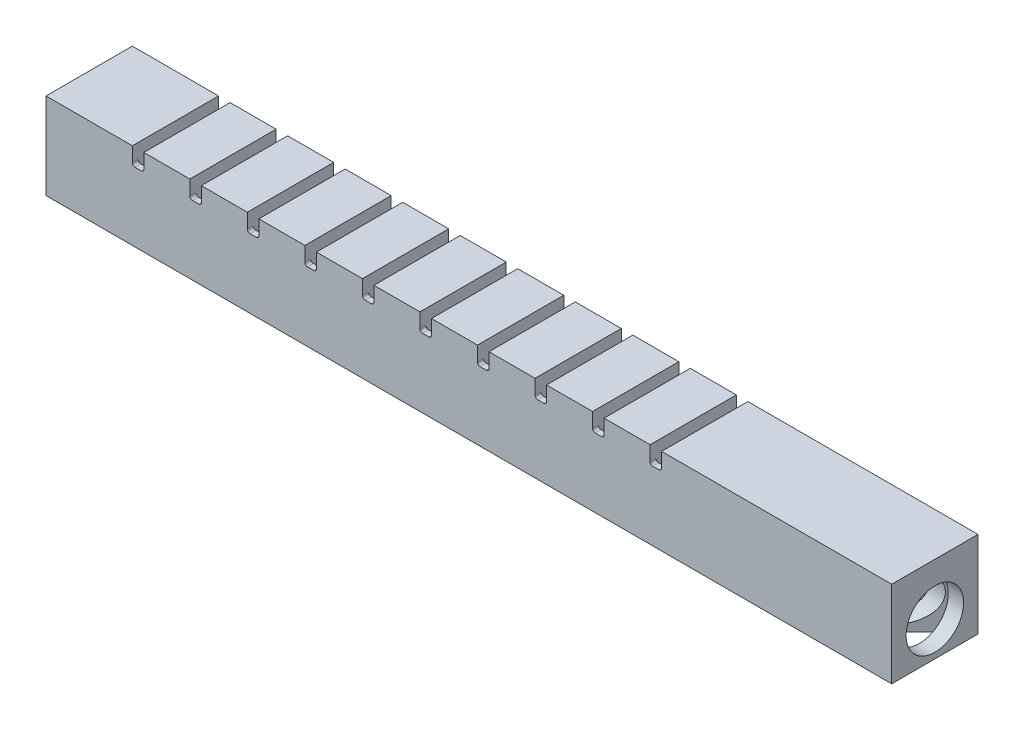
from build123d import *

# Parameters (mm, degrees)
SKETCH1_W                       = 8
SKETCH1_H                       = 15
FIRST_CHAMBER_BLOCK_DEPTH       = 15
SKETCH2_W                       = 6
SKETCH2_H                       = 11
FIRST_CHAMBER_CAVITY_DEPTH      = 13
SKETCH3_W                       = 15
SKETCH3_H                       = 3
CHAMBER_SPACER_DEPTH            = 2
PATTERN_CHAMBERS_COUNT          = 11
PATTERN_CHAMBERS_PITCH          = 10
SKETCH4_W                       = 15
SKETCH4_H                       = 12
THICKEN_END_1_DEPTH             = 2
SKETCH5_W                       = 15
SKETCH5_H                       = 15
THICKEN_END_2_DEPTH             = 2
SKETCH6_W                       = 94
SKETCH6_H                       = 2
CENTRAL_AIR_CHANNEL_DEPTH       = 2
AUFSATZ_LINEAR_AUSTRAGEN3_REACH = 106.183
SCHNITT_LINEAR_AUSTRAGEN2_DEPTH = 113.026782512
LINEARES_MUSTER8_COUNT          = 10
LINEARES_MUSTER8_PITCH          = 10
SKETCH17_W                      = 15
SKETCH17_H                      = 15
BOSS_EXTRUDE1_DEPTH             = 30
SKETCH18_W                      = 15
SKETCH18_H                      = 15
BOSS_EXTRUDE2_DEPTH             = 5
CUT_EXTRUDE1_DEPTH              = 12
SCHNITT_LINEAR_AUSTRAGEN3_REACH = 150.523
SKIZZE6_R                       = 5


with BuildPart() as part:
    # Sketch1 → first chamber block (new body)
    with BuildSketch(Plane.XY):
        with Locations((4, 7.5)):
            Rectangle(SKETCH1_W, SKETCH1_H)
    extrude(amount=FIRST_CHAMBER_BLOCK_DEPTH)

    # Sketch2 → first chamber cavity (cut)
    with BuildSketch(Plane.XZ):
        with Locations((4, 7.5)):
            Rectangle(SKETCH2_W, SKETCH2_H)
    extrude(amount=-FIRST_CHAMBER_CAVITY_DEPTH, mode=Mode.SUBTRACT)

    # Sketch3 → chamber spacer (add)
    with BuildSketch(Plane(origin=(8, 0, 0), x_dir=(0, 0, -1), z_dir=(1, 0, 0))):
        with Locations((-7.5, 1.5)):
            Rectangle(SKETCH3_W, SKETCH3_H)
    extrude(amount=CHAMBER_SPACER_DEPTH)


with BuildPart() as pattern_chambers_1:
    # pattern chambers: pattern copy
    add(part.part.moved(Location(Vector(1, 0, 0) * (1 * PATTERN_CHAMBERS_PITCH))))


with BuildPart() as pattern_chambers_2:
    # pattern chambers: pattern copy
    add(part.part.moved(Location(Vector(1, 0, 0) * (2 * PATTERN_CHAMBERS_PITCH))))


with BuildPart() as pattern_chambers_3:
    # pattern chambers: pattern copy
    add(part.part.moved(Location(Vector(1, 0, 0) * (3 * PATTERN_CHAMBERS_PITCH))))


with BuildPart() as pattern_chambers_4:
    # pattern chambers: pattern copy
    add(part.part.moved(Location(Vector(1, 0, 0) * (4 * PATTERN_CHAMBERS_PITCH))))


with BuildPart() as pattern_chambers_5:
    # pattern chambers: pattern copy
    add(part.part.moved(Location(Vector(1, 0, 0) * (5 * PATTERN_CHAMBERS_PITCH))))


with BuildPart() as pattern_chambers_6:
    # pattern chambers: pattern copy
    add(part.part.moved(Location(Vector(1, 0, 0) * (6 * PATTERN_CHAMBERS_PITCH))))


with BuildPart() as pattern_chambers_7:
    # pattern chambers: pattern copy
    add(part.part.moved(Location(Vector(1, 0, 0) * (7 * PATTERN_CHAMBERS_PITCH))))


with BuildPart() as pattern_chambers_8:
    # pattern chambers: pattern copy
    add(part.part.moved(Location(Vector(1, 0, 0) * (8 * PATTERN_CHAMBERS_PITCH))))


with BuildPart() as pattern_chambers_9:
    # pattern chambers: pattern copy
    add(part.part.moved(Location(Vector(1, 0, 0) * (9 * PATTERN_CHAMBERS_PITCH))))


with BuildPart() as pattern_chambers_10:
    # pattern chambers: pattern copy
    add(part.part.moved(Location(Vector(1, 0, 0) * (10 * PATTERN_CHAMBERS_PITCH))))

    # combine into 1 solid body: union pattern chambers_9, pattern chambers_8, pattern chambers_7, pattern chambers_6, pattern chambers_5, pattern chambers_4, pattern chambers_3, pattern chambers_2, pattern chambers_1, part
    add(pattern_chambers_9.part)
    add(pattern_chambers_8.part)
    add(pattern_chambers_7.part)
    add(pattern_chambers_6.part)
    add(pattern_chambers_5.part)
    add(pattern_chambers_4.part)
    add(pattern_chambers_3.part)
    add(pattern_chambers_2.part)
    add(pattern_chambers_1.part)
    add(part.part)

    # Sketch4 → thicken end 1 (add)
    with BuildSketch(Plane(origin=(108, 0, 0), x_dir=(0, 0, -1), z_dir=(1, 0, 0))):
        with Locations((-7.5, 9)):
            Rectangle(SKETCH4_W, SKETCH4_H)
    extrude(amount=THICKEN_END_1_DEPTH)

    # Sketch5 → thicken end 2 (add)
    with BuildSketch(Plane.ZY):
        with Locations((7.5, 7.5)):
            Rectangle(SKETCH5_W, SKETCH5_H)
    extrude(amount=THICKEN_END_2_DEPTH)

    # Sketch6 → central air channel (cut)
    with BuildSketch(Plane.XZ):
        with Locations((54, 7.5)):
            Rectangle(SKETCH6_W, SKETCH6_H)
    extrude(amount=-CENTRAL_AIR_CHANNEL_DEPTH, mode=Mode.SUBTRACT)

    # Skizze3 → Aufsatz-Linear austragen3 (add, up to next)
    with BuildSketch(Plane(origin=(8, 0, 0), x_dir=(0, 0, -1), z_dir=(1, 0, 0)), mode=Mode.PRIVATE) as aufsatz_linear_austragen3_sk1:
        Polygon((-15, 3), (-13.5, 3), (-14, 12.5), (-15, 12.5), align=None)
    aufsatz_linear_austragen3_tool1 = extrude(aufsatz_linear_austragen3_sk1.sketch, amount=AUFSATZ_LINEAR_AUSTRAGEN3_REACH, mode=Mode.PRIVATE) - pattern_chambers_10.part
    # Skizze3 → Aufsatz-Linear austragen3 (add, up to next)
    with BuildSketch(Plane(origin=(8, 0, 0), x_dir=(0, 0, -1), z_dir=(1, 0, 0)), mode=Mode.PRIVATE) as aufsatz_linear_austragen3_sk2:
        Polygon((0, 12.5), (0, 3), (-1.5, 3), (-1, 12.5), align=None)
    aufsatz_linear_austragen3_tool2 = extrude(aufsatz_linear_austragen3_sk2.sketch, amount=AUFSATZ_LINEAR_AUSTRAGEN3_REACH, mode=Mode.PRIVATE) - pattern_chambers_10.part
    aufsatz_linear_austragen3_1 = aufsatz_linear_austragen3_tool1.solids().sort_by_distance((8, 7.433333, 14.366667))[0]
    add(aufsatz_linear_austragen3_1)
    aufsatz_linear_austragen3_2 = aufsatz_linear_austragen3_tool2.solids().sort_by_distance((8, 7.433333, 0.633333))[0]
    add(aufsatz_linear_austragen3_2)
    aufsatz_linear_austragen3 = aufsatz_linear_austragen3_1 + aufsatz_linear_austragen3_2  # Aufsatz-Linear austragen3 as one shape, for the pattern or mirror that repeats it

    # Skizze5 → Schnitt-Linear austragen2 (cut, through all)
    with BuildSketch(Plane(origin=(0, 0, 0), x_dir=(-1, 0, 0), z_dir=(0, 0, -1))):
        with BuildLine():
            Line((-10, 12.5), (-8, 12.5))
            Line((-8, 12.5), (-8, 12.45))
            ThreePointArc((-8, 12.45), (-8.131801948, 12.131801948), (-8.45, 12))
            Line((-8.45, 12), (-9.55, 12))
            ThreePointArc((-9.55, 12), (-9.868198052, 12.131801948), (-10, 12.45))
            Line((-10, 12.45), (-10, 12.5))
        make_face()
    schnitt_linear_austragen2 = extrude(amount=-SCHNITT_LINEAR_AUSTRAGEN2_DEPTH, mode=Mode.SUBTRACT)

    # Lineares Muster8: Aufsatz-Linear austragen3, Schnitt-Linear austragen2 ×10
    with Locations(*[(i * LINEARES_MUSTER8_PITCH, 0, 0) for i in range(1, LINEARES_MUSTER8_COUNT)]):
        add(aufsatz_linear_austragen3)
        add(schnitt_linear_austragen2, mode=Mode.SUBTRACT)

    # Sketch17 → Boss-Extrude1 (add)
    with BuildSketch(Plane(origin=(110, 0, 0), x_dir=(0, 0, -1), z_dir=(1, 0, 0))):
        with Locations((-7.5, 7.5)):
            Rectangle(SKETCH17_W, SKETCH17_H)
    extrude(amount=BOSS_EXTRUDE1_DEPTH)

    # Sketch18 → Boss-Extrude2 (add)
    with BuildSketch(Plane.ZY.offset(2)):
        with Locations((7.5, 7.5)):
            Rectangle(SKETCH18_W, SKETCH18_H)
    extrude(amount=BOSS_EXTRUDE2_DEPTH)

    # Sketch19 → Cut-Extrude1 (cut)
    with BuildSketch(Plane.XZ):
        Polygon((131.828427125, 7.5), (137.328427125, 2), (137.328427125, 13), align=None)
        Polygon((126.328427125, 2), (134.5, 2), (130.414213562, 6.085786438), align=None)
        Polygon((130.414213562, 8.914213562), (134.5, 13), (126.328427125, 13), align=None)
        Polygon((112.5, 2), (120.671572875, 2), (116.585786438, 6.085786438), align=None)
        Polygon((118, 7.5), (122.5, 3), (122.5, 12), align=None)
        Polygon((124.5, 12), (124.5, 3), (129, 7.5), align=None)
        Polygon((116.585786438, 8.914213562), (120.671572875, 13), (112.5, 13), align=None)
        Polygon((109.671572875, 13), (109.671572875, 2), (115.171572875, 7.5), align=None)
    extrude(amount=-CUT_EXTRUDE1_DEPTH, mode=Mode.SUBTRACT)

    # Schnitt-Linear austragen3: up to this face of the body (flat: up to its plane)
    schnitt_linear_austragen3_end = Plane(pattern_chambers_10.part.faces().sort_by_distance((101, 6.658273381, 7.5))[0])
    # Skizze6 → Schnitt-Linear austragen3 (cut, up to the picked face)
    with BuildSketch(Plane(origin=(140, 0, 0), x_dir=(0, 0, -1), z_dir=(1, 0, 0)), mode=Mode.PRIVATE) as schnitt_linear_austragen3_sk1:
        with Locations(Location((-7.5, 6, 0), (0, 0, 270))):
            Circle(SKIZZE6_R)
    schnitt_linear_austragen3_tool1 = split(extrude(schnitt_linear_austragen3_sk1.sketch, amount=-SCHNITT_LINEAR_AUSTRAGEN3_REACH, mode=Mode.PRIVATE), bisect_by=schnitt_linear_austragen3_end, keep=Keep.BOTH, mode=Mode.PRIVATE)
    add(schnitt_linear_austragen3_tool1.solids().sort_by(Axis((140, 6, 7.5), (-1, 0, 0)))[0], mode=Mode.SUBTRACT)


solid = pattern_chambers_10.part
